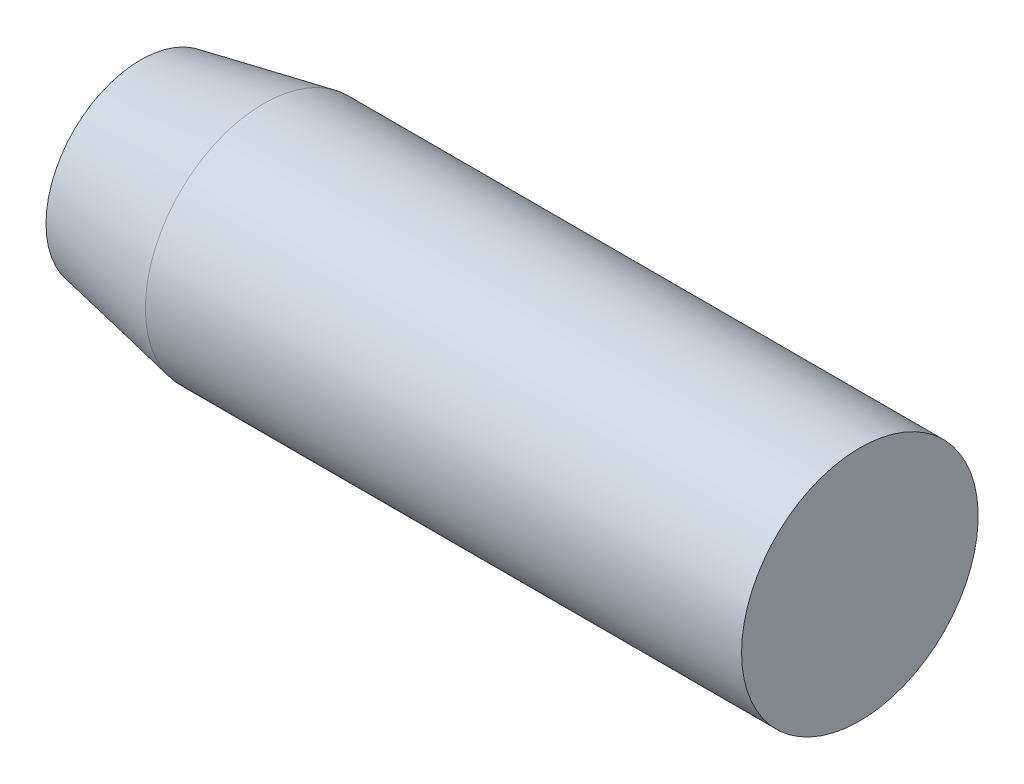
from build123d import *


with BuildPart() as part:
    # Sketch1 → Revolve1 (revolve)
    with BuildSketch(Plane(origin=(0, 0, 0), x_dir=(1, 0, 0), z_dir=(0, 1, 0))):
        Polygon((0, 0), (38, 0), (38, 6.25), (6.5, 6.25), (0, 5), align=None)
    revolve(axis=Axis((0, 0, 0), (1, 0, 0)))


solid = part.part
